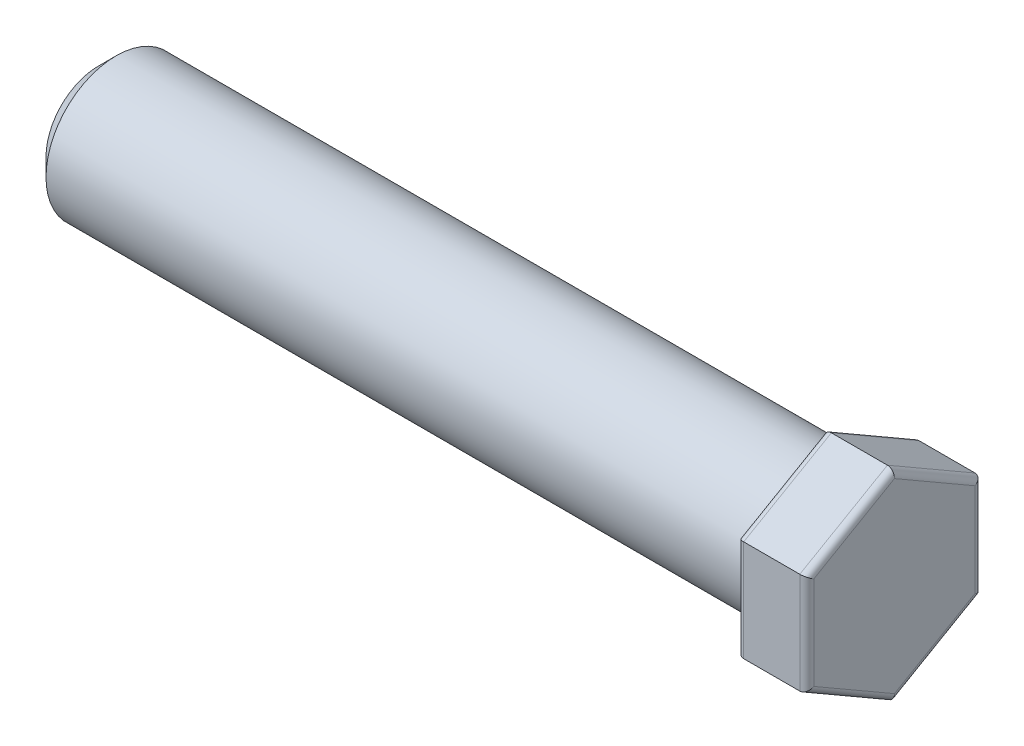
from build123d import *

# Parameters (mm, degrees)
BOSS_EXTRUDE1_DEPTH = 1
FILLET1_R           = 0.2
SKETCH2_R           = 2
BOSS_EXTRUDE2_DEPTH = 20.7
CHAMFER1_SIZE       = 0.5
FILLET2_R           = 0.2


with BuildPart() as part:
    # Sketch1 → Boss-Extrude1 (new, symmetric)
    with BuildSketch(Plane(origin=(0, 0, 0), x_dir=(0, 0, -1), z_dir=(1, 0, 0))):
        Polygon((0, 2.886751346), (-2.5, 1.443375673), (-2.5, -1.443375673), (0, -2.886751346), (2.5, -1.443375673), (2.5, 1.443375673), align=None)
    extrude(amount=BOSS_EXTRUDE1_DEPTH, both=True)

    # Fillet1
    fillet1_edges = [part.edges().sort_by_distance(p)[0] for p in [
        (1, 0, 2.5),
        (1, -2.165063509, 1.25),
        (1, -2.165063509, -1.25),
        (1, 0, -2.5),
        (1, 2.165063509, -1.25),
        (-1, 0, -2.5),
        (-1, -2.165063509, -1.25),
        (-1, -2.165063509, 1.25),
        (-1, 0, 2.5),
        (-1, 2.165063509, 1.25),
        (-1, 2.165063509, -1.25),
        (1, 2.165063509, 1.25),
    ]]
    fillet(fillet1_edges, radius=FILLET1_R)

    # Sketch2 → Boss-Extrude2 (add)
    with BuildSketch(Plane.ZY.offset(1)):
        with Locations(Location((0, 0, 0), (0, 0, 180))):
            Circle(SKETCH2_R)
    extrude(amount=BOSS_EXTRUDE2_DEPTH)

    # Chamfer1
    chamfer1_edges = [part.edges().sort_by_distance(p)[0] for p in [
        (-21.7, 0, 2),
    ]]
    chamfer(chamfer1_edges, length=CHAMFER1_SIZE)

    # Fillet2
    fillet2_edges = [part.edges().sort_by_distance(p)[0] for p in [
        (-1, 0, 2),
    ]]
    fillet(fillet2_edges, radius=FILLET2_R)


solid = part.part
